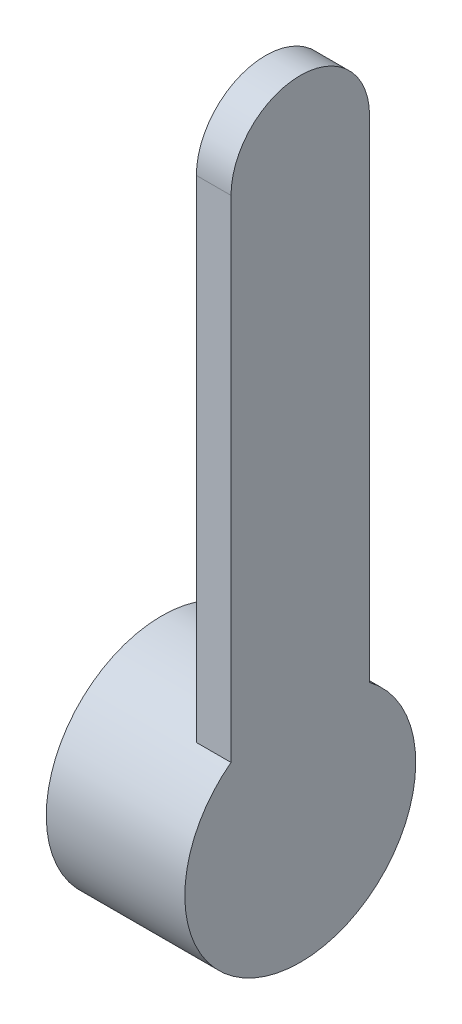
from build123d import *

# Parameters (mm, degrees)
SKETCH1_R           = 2.5
SKETCH1_R_2         = 1.5
BOSS_EXTRUDE1_DEPTH = 3
BOSS_EXTRUDE2_START = -0.75
BOSS_EXTRUDE2_DEPTH = 0.75


with BuildPart() as part:
    # Sketch1 → Boss-Extrude1 (new body)
    with BuildSketch(Plane(origin=(0, 0, 0), x_dir=(0, 0, -1), z_dir=(1, 0, 0))):
        Circle(SKETCH1_R)
        Circle(SKETCH1_R_2, mode=Mode.SUBTRACT)
    extrude(amount=BOSS_EXTRUDE1_DEPTH)

    # Sketch2 → Boss-Extrude2 (add)
    with BuildSketch(Plane(origin=(3, 0, 0), x_dir=(0, 0, -1), z_dir=(1, 0, 0)).offset(BOSS_EXTRUDE2_START)):
        with BuildLine():
            Line((-1.5, 2), (-1.5, 12.632795692))
            ThreePointArc((-1.5, 12.632795692), (0, 14.132795692), (1.5, 12.632795692))
            Line((1.5, 12.632795692), (1.5, 2))
            ThreePointArc((1.5, 2), (0, -2.5), (-1.5, 2))
        make_face()
    extrude(amount=BOSS_EXTRUDE2_DEPTH)


solid = part.part
